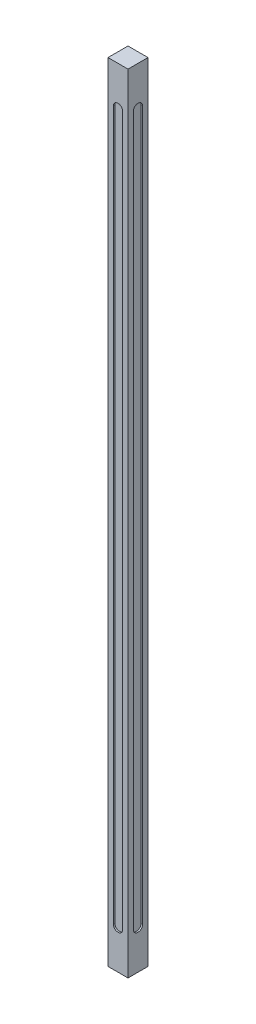
from build123d import *

# Parameters (mm, degrees)
SKETCH1_W           = 25.4
SKETCH1_H           = 25.4
BOSS_EXTRUDE1_DEPTH = 500
CUT_EXTRUDE2_DEPTH  = 2
CUT_EXTRUDE3_DEPTH  = 2
CUT_EXTRUDE4_START  = -2
CUT_EXTRUDE4_DEPTH  = 2
CUT_EXTRUDE5_START  = -2
CUT_EXTRUDE5_DEPTH  = 2


with BuildPart() as part:
    # Sketch1 → Boss-Extrude1 (new, symmetric)
    with BuildSketch(Plane(origin=(0, 0, 0), x_dir=(1, 0, 0), z_dir=(0, 1, 0))):
        Rectangle(SKETCH1_W, SKETCH1_H)
    extrude(amount=BOSS_EXTRUDE1_DEPTH, both=True)

    # Sketch5 → Cut-Extrude2 (cut)
    with BuildSketch(Plane.XY.offset(12.7)):
        with BuildLine():
            Line((6, 450), (6, -450))
            ThreePointArc((6, -450), (0, -456), (-6, -450))
            Line((-6, -450), (-6, 450))
            ThreePointArc((-6, 450), (0, 456), (6, 450))
        make_face()
    extrude(amount=-CUT_EXTRUDE2_DEPTH, mode=Mode.SUBTRACT)

    # Sketch6 → Cut-Extrude3 (cut)
    with BuildSketch(Plane(origin=(12.7, 0, 0), x_dir=(0, 0, -1), z_dir=(1, 0, 0))):
        with BuildLine():
            Line((6, 450), (6, -450))
            ThreePointArc((6, -450), (0, -456), (-6, -450))
            Line((-6, -450), (-6, 450))
            ThreePointArc((-6, 450), (0, 456), (6, 450))
        make_face()
    extrude(amount=-CUT_EXTRUDE3_DEPTH, mode=Mode.SUBTRACT)

    # Sketch8 → Cut-Extrude4 (cut)
    with BuildSketch(Plane(origin=(0, 0, -12.7), x_dir=(-1, 0, 0), z_dir=(0, 0, -1)).offset(CUT_EXTRUDE4_START)):
        with BuildLine():
            Line((6, 450), (6, -450))
            ThreePointArc((6, -450), (0, -456), (-6, -450))
            Line((-6, -450), (-6, 450))
            ThreePointArc((-6, 450), (0, 456), (6, 450))
        make_face()
    extrude(amount=CUT_EXTRUDE4_DEPTH, mode=Mode.SUBTRACT)

    # Sketch9 → Cut-Extrude5 (cut)
    with BuildSketch(Plane.ZY.offset(12.7).offset(CUT_EXTRUDE5_START)):
        with BuildLine():
            Line((6, 450), (6, -450))
            ThreePointArc((6, -450), (0, -456), (-6, -450))
            Line((-6, -450), (-6, 450))
            ThreePointArc((-6, 450), (0, 456), (6, 450))
        make_face()
    extrude(amount=CUT_EXTRUDE5_DEPTH, mode=Mode.SUBTRACT)


solid = part.part
